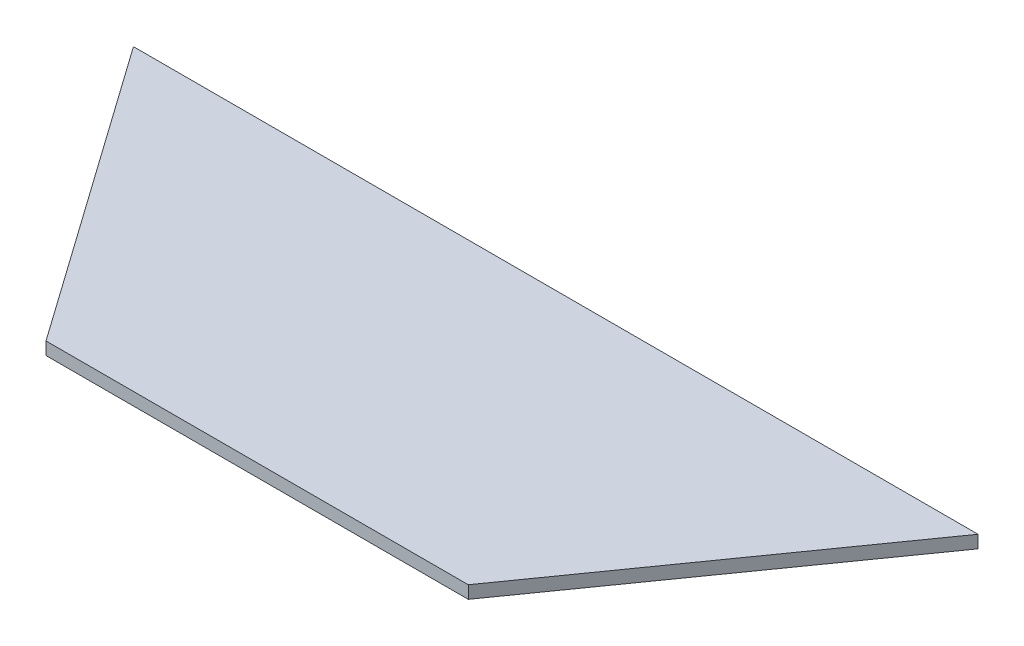
from build123d import *

# Parameters (mm, degrees)
BOSS_EXTRUDE1_DEPTH = 1.5


with BuildPart() as part:
    # Sketch1 → Boss-Extrude1 (new body)
    with BuildSketch(Plane(origin=(0, 0, 0), x_dir=(1, 0, 0), z_dir=(0, 1, 0))):
        Polygon((-50, 35.355339059), (-25, 0), (25, 0), (50, 35.355339059), align=None)
    extrude(amount=BOSS_EXTRUDE1_DEPTH)


solid = part.part
